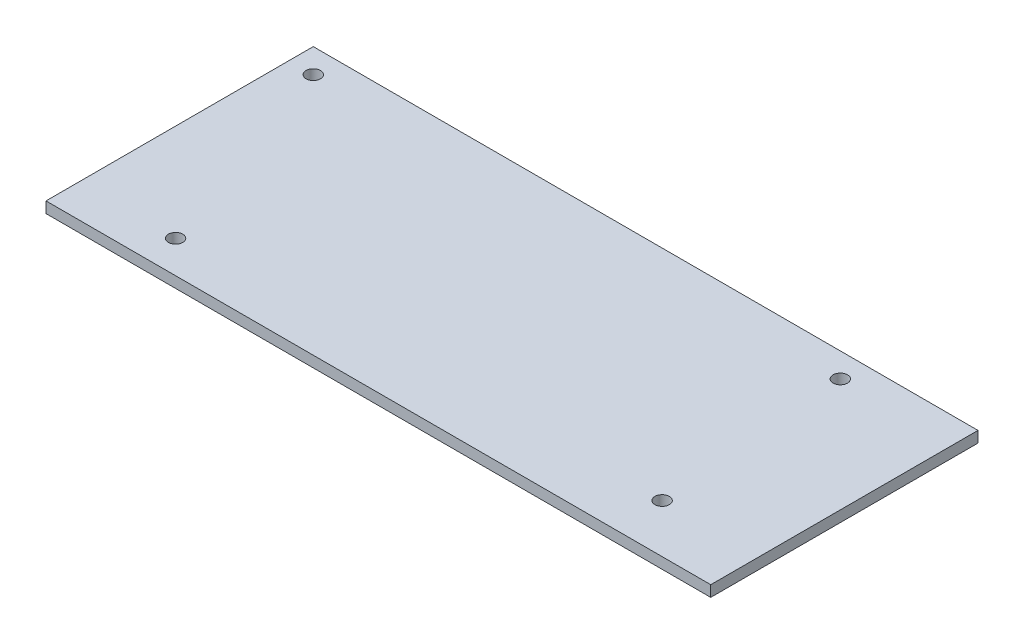
from build123d import *

# Parameters (mm, degrees)
SKETCH1_W             = 104.2416
SKETCH1_H             = 41.91
BOSS_EXTRUDE1_DEPTH   = 0.8636
F_4_40_TAPPED_HOLE1_D = 2.2606


with BuildPart() as part:
    # Sketch1 → Boss-Extrude1 (new, symmetric)
    with BuildSketch(Plane(origin=(0, 0, 0), x_dir=(1, 0, 0), z_dir=(0, 1, 0))):
        Rectangle(SKETCH1_W, SKETCH1_H)
    extrude(amount=BOSS_EXTRUDE1_DEPTH, both=True)

    # #4-40 Tapped Hole1 (through all)
    with Locations(Plane(origin=(0, 0.8636, 0), x_dir=(1, 0, 0), z_dir=(0, 1, 0))):
        with Locations((-48.3108, 17.145), (-36.8808, -15.875), (34.3408, 17.145), (36.8808, -13.335)):
            Hole(F_4_40_TAPPED_HOLE1_D / 2)


solid = part.part
